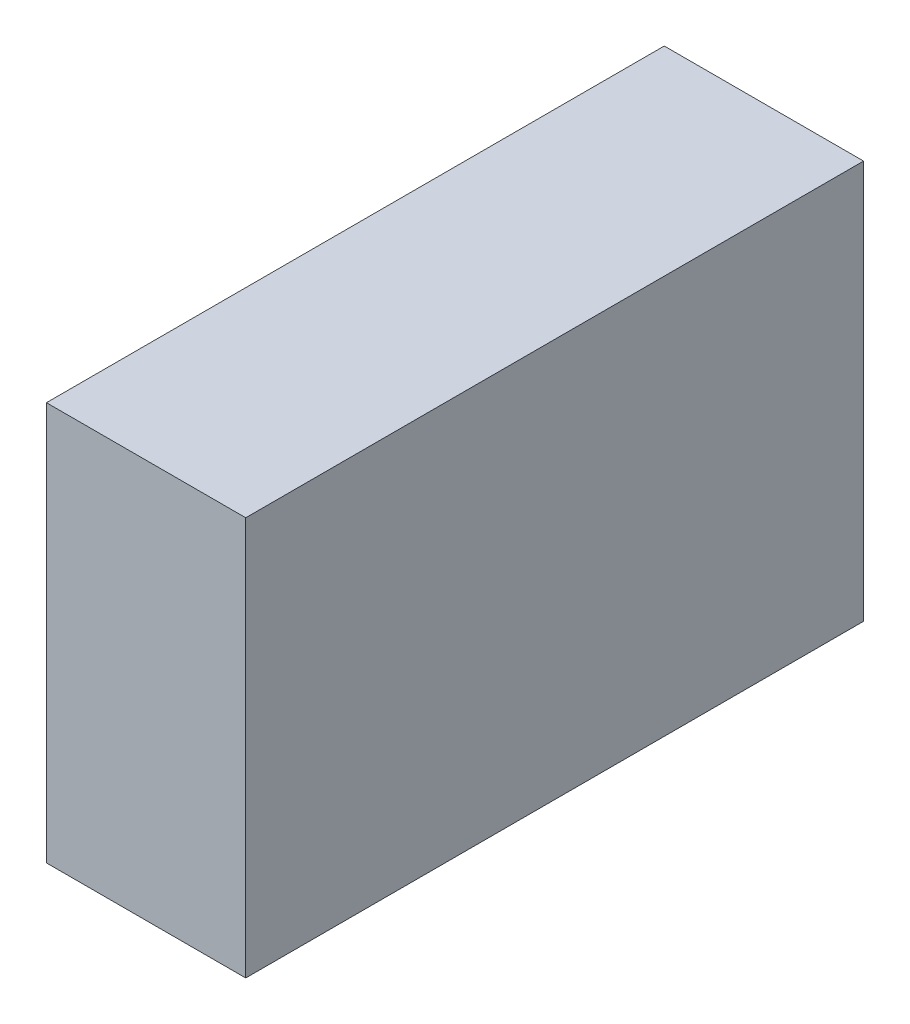
from build123d import *

# Parameters (mm, degrees)
SKETCH1_W           = 31
SKETCH1_H           = 20
BOSS_EXTRUDE1_DEPTH = 10


with BuildPart() as part:
    # Sketch1 → Boss-Extrude1 (new body)
    with BuildSketch(Plane(origin=(0, 0, 0), x_dir=(0, 0, -1), z_dir=(1, 0, 0))):
        with Locations((15.5, 10)):
            Rectangle(SKETCH1_W, SKETCH1_H)
    extrude(amount=BOSS_EXTRUDE1_DEPTH)


solid = part.part
